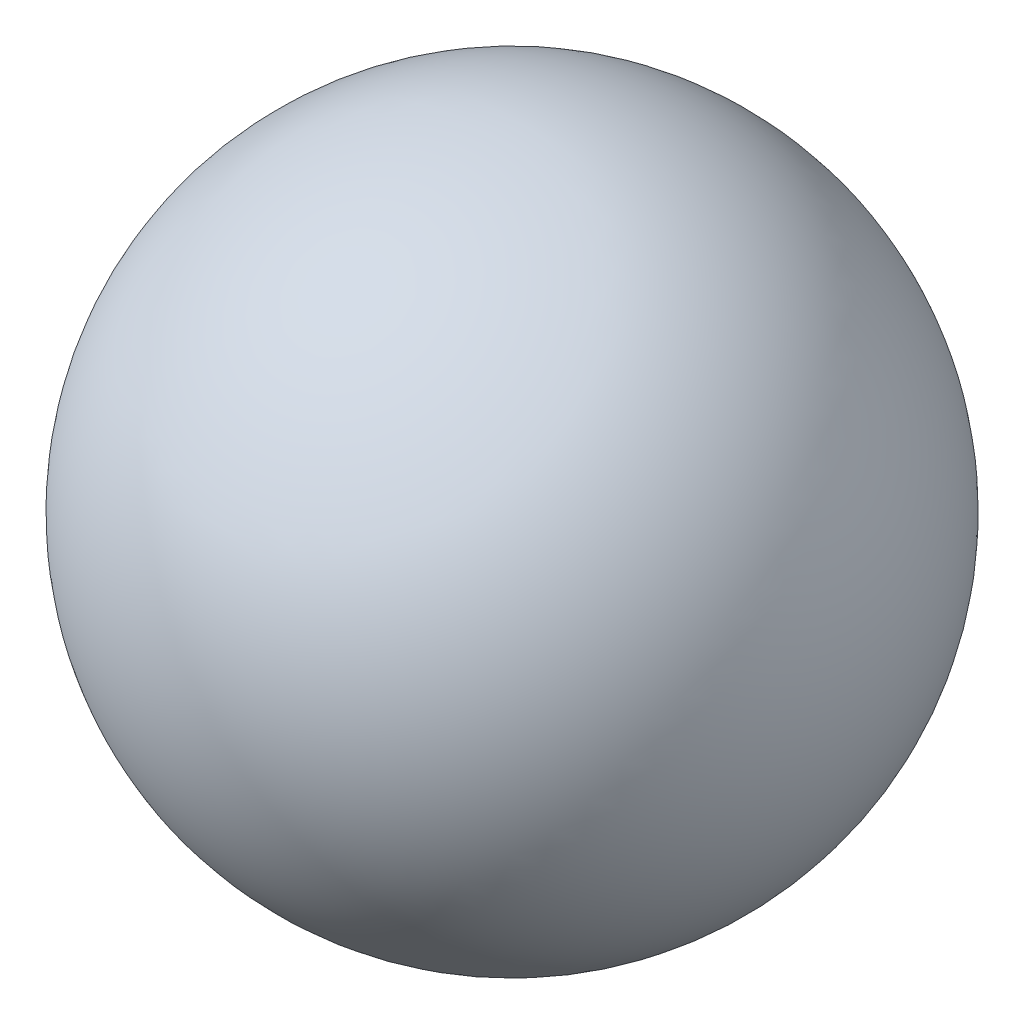
from build123d import *


with BuildPart() as part:
    # Sketch1 → Revolve1 (revolve)
    with BuildSketch(Plane(origin=(0, 0, 0), x_dir=(1, 0, 0), z_dir=(0, 1, 0))):
        with BuildLine():
            Line((0, -43.053), (0, 43.053))
            ThreePointArc((0, 43.053), (43.053, 0), (0, -43.053))
        make_face()
    revolve(axis=Axis((0, 0, 43.053), (0, 0, -1)))


solid = part.part
